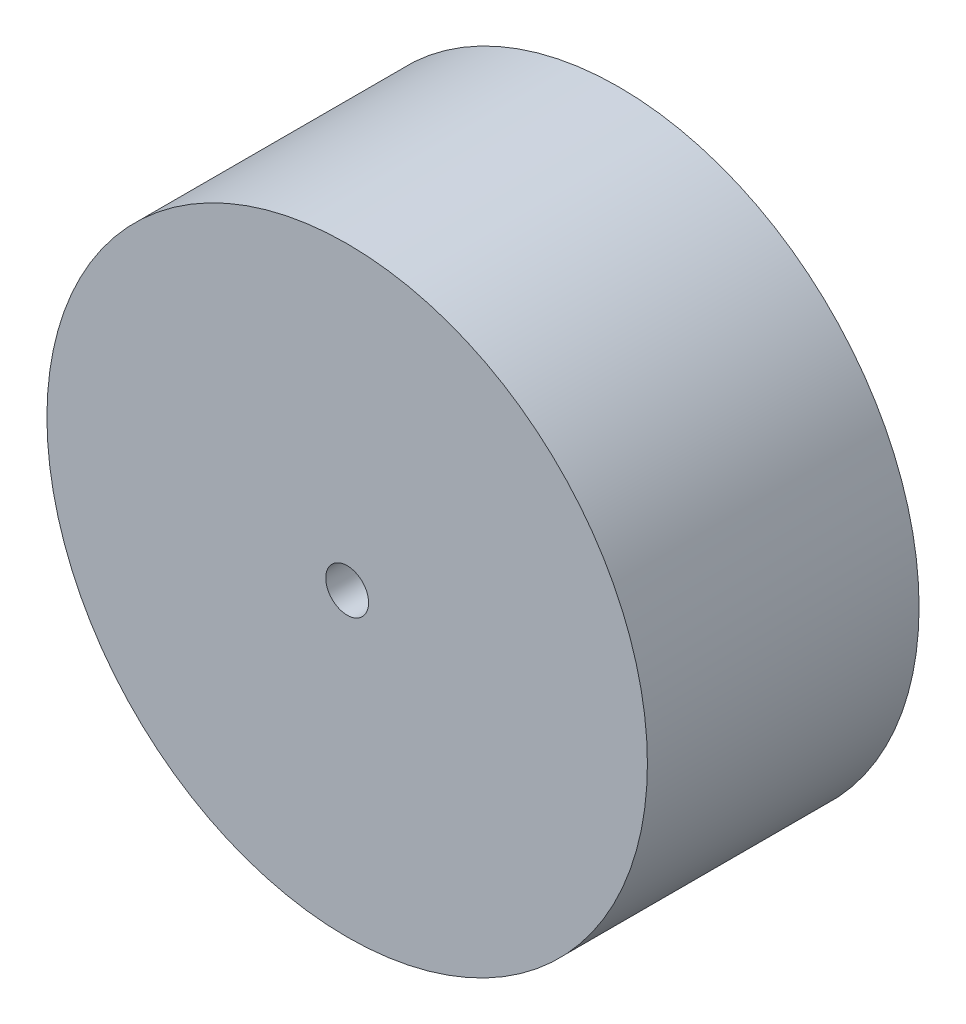
from build123d import *

# Parameters (mm, degrees)
SKETCH1_R           = 21
BOSS_EXTRUDE1_DEPTH = 19
SKETCH2_R           = 1.5
CUT_EXTRUDE1_DEPTH  = 36.256205128


with BuildPart() as part:
    # Sketch1 → Boss-Extrude1 (new body)
    with BuildSketch(Plane.XY):
        Circle(SKETCH1_R)
    extrude(amount=BOSS_EXTRUDE1_DEPTH)

    # Sketch2 → Cut-Extrude1 (cut, through all)
    with BuildSketch(Plane.XY.offset(19)):
        Circle(SKETCH2_R)
    extrude(amount=-CUT_EXTRUDE1_DEPTH, mode=Mode.SUBTRACT)


solid = part.part
